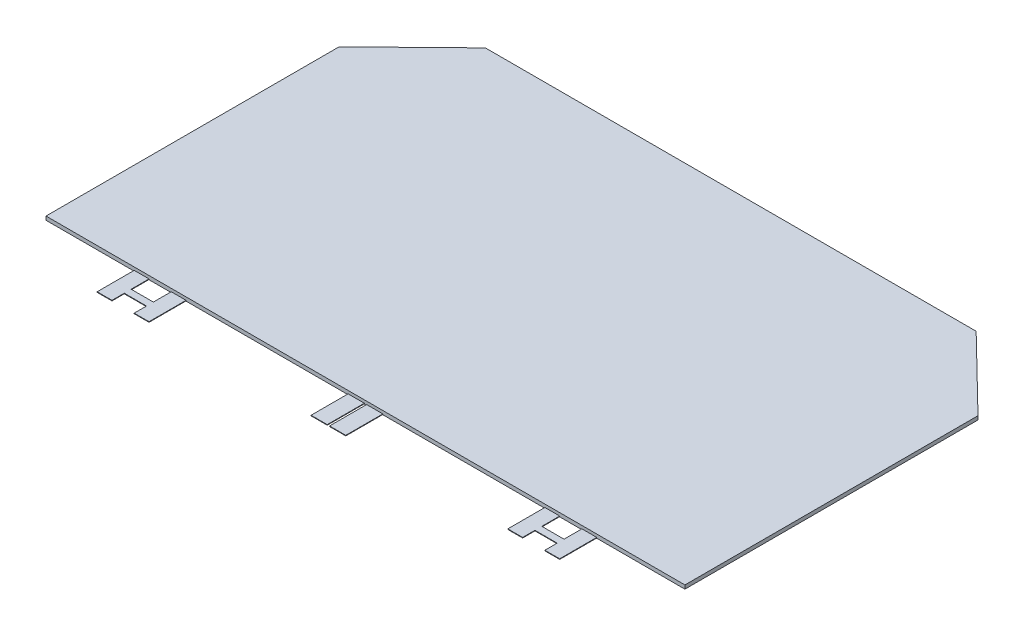
from build123d import *

# Parameters (mm, degrees)
BOSS_EXTRUDE1_DEPTH = 0.4
SKETCH2_W           = 2.4
SKETCH2_H           = 0.74
SKETCH2_W_2         = 1.75
SKETCH2_H_2         = 4
BOSS_EXTRUDE2_DEPTH = 0.06


with BuildPart() as part:
    # Sketch1 → Boss-Extrude1 (new body)
    with BuildSketch(Plane(origin=(0, 0, 0), x_dir=(1, 0, 0), z_dir=(0, 1, 0))):
        Polygon((8, 39.45), (0, 31.65), (0, 0), (69, 0), (69, 31.65), (61, 39.45), align=None)
    extrude(amount=BOSS_EXTRUDE1_DEPTH)


with BuildPart() as body_2:
    # Sketch2 → Boss-Extrude2 (new body)
    with BuildSketch(Plane.XZ.offset(-0.02)):
        Polygon((9.525, 4), (9.525, 0), (11.125, 0), (11.125, 1.93), (11.125, 2.67), (11.125, 4), align=None)
        Polygon((13.525, 1.93), (13.525, 0), (15.125, 0), (15.125, 4), (13.525, 4), (13.525, 2.67), align=None)
        with Locations((12.325, 2.3)):
            Rectangle(SKETCH2_W, SKETCH2_H)
        with Locations((33.5, 2)):
            Rectangle(SKETCH2_W_2, SKETCH2_H_2)
        with Locations((35.5, 2)):
            Rectangle(SKETCH2_W_2, SKETCH2_H_2)
        Polygon((53.875, 0), (55.475, 0), (55.475, 1.93), (55.475, 2.67), (55.475, 4), (53.875, 4), align=None)
        with Locations((56.675, 2.3)):
            Rectangle(SKETCH2_W, SKETCH2_H)
        Polygon((57.875, 1.93), (57.875, 0), (59.475, 0), (59.475, 4), (57.875, 4), (57.875, 2.67), align=None)
    extrude(amount=-BOSS_EXTRUDE2_DEPTH)


solid = Compound([part.part, body_2.part])
